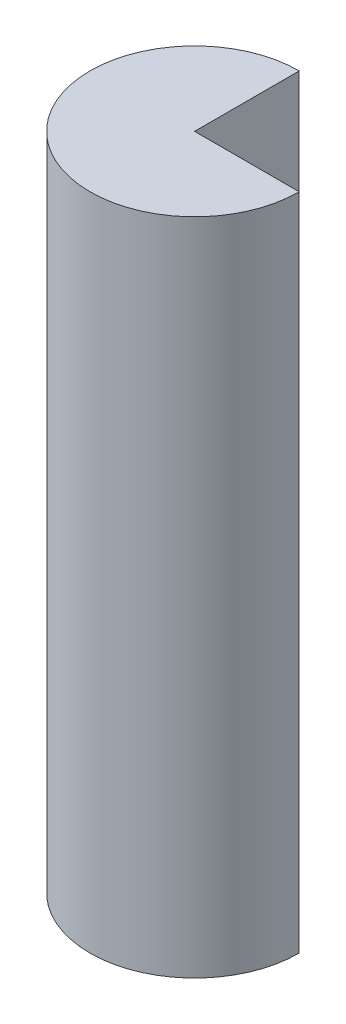
from build123d import *

# Parameters (mm, degrees)
BOSS_EXTRUDE1_DEPTH = 80


with BuildPart() as part:
    # Sketch1 → Boss-Extrude1 (new body)
    with BuildSketch(Plane(origin=(0, 0, 0), x_dir=(1, 0, 0), z_dir=(0, 1, 0))):
        with BuildLine():
            Line((0, 0), (0, 12.7))
            ThreePointArc((0, 12.7), (-8.980256121, -8.980256121), (12.7, 0))
            Line((12.7, 0), (0, 0))
        make_face()
    extrude(amount=BOSS_EXTRUDE1_DEPTH)


solid = part.part
